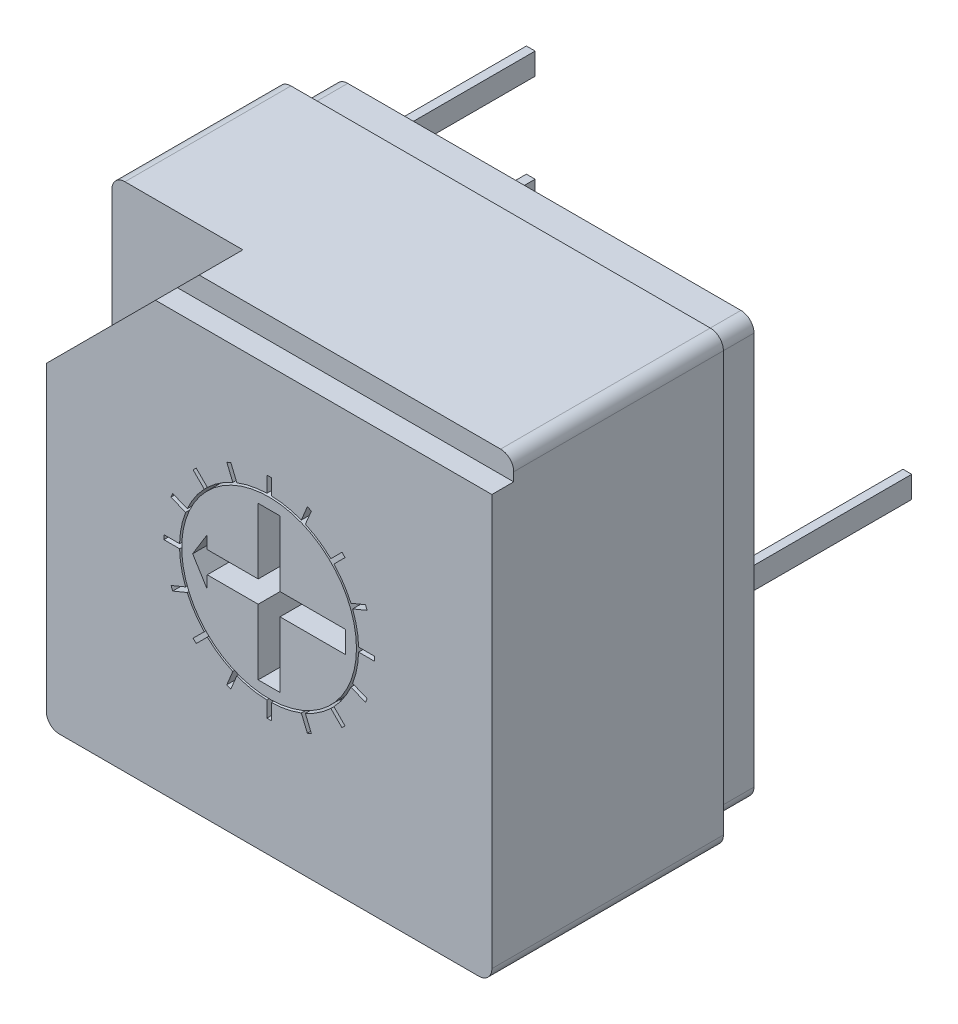
from build123d import *

# Parameters (mm, degrees)
SKETCH1_W               = 10.2
SKETCH1_H               = 10.2
BOSS_EXTRUDE2_DEPTH     = 6.5
SKETCH3_R               = 0.501534086
BOSS_EXTRUDE3_DEPTH     = 0.5
FILLET1_R               = 0.3
SKETCH4_W               = 10.2
SKETCH4_H               = 10.2
SKETCH4_W_2             = 9.6
SKETCH4_H_2             = 9.6
CUT_EXTRUDE_THIN1_DEPTH = 1
FILLET2_R               = 0.3
SKETCH5_W               = 0.2
SKETCH5_H               = 0.5
BOSS_EXTRUDE5_DEPTH     = 3.5
SKETCH6_W               = 0.2
SKETCH6_H               = 0.5
BOSS_EXTRUDE6_DEPTH     = 1
SKETCH7_W               = 10.2
SKETCH7_H               = 10.2
CUT_EXTRUDE3_DEPTH      = 0.2
CUT_EXTRUDE4_DEPTH      = 1.5
CUT_EXTRUDE5_DEPTH      = 0.5
SKETCH10_R              = 2.05
SKETCH10_R_2            = 2
CUT_EXTRUDE6_DEPTH      = 0.5
CUT_EXTRUDE7_DEPTH      = 1
CUT_EXTRUDE8_DEPTH      = 0.3


with BuildPart() as part:
    # Sketch1 → Boss-Extrude2 (new body)
    with BuildSketch(Plane.XY):
        with Locations((5.1, 5.1)):
            Rectangle(SKETCH1_W, SKETCH1_H)
    extrude(amount=BOSS_EXTRUDE2_DEPTH)

    # Sketch3 → Boss-Extrude3 (add)
    with BuildSketch(Plane(origin=(0, 0, 0), x_dir=(-1, 0, 0), z_dir=(0, 0, -1))):
        with Locations((-8.2, 8.2)):
            Circle(SKETCH3_R)
        with Locations(Location((-2, 8.2, 0), (0, 0, 180))):
            Circle(SKETCH3_R)
        with Locations(Location((-8.2, 2, 0), (0, 0, 180))):
            Circle(SKETCH3_R)
        with Locations((-2, 2)):
            Circle(SKETCH3_R)
    extrude(amount=BOSS_EXTRUDE3_DEPTH)

    # Fillet1
    fillet1_edges = [part.edges().sort_by_distance(p)[0] for p in [
        (0, 10.2, 3.25),
        (10.2, 10.2, 3.25),
        (10.2, 0, 3.25),
        (0, 0, 3.25),
    ]]
    fillet(fillet1_edges, radius=FILLET1_R)

    # Sketch4 → Cut-Extrude-Thin1 (cut)
    with BuildSketch(Plane(origin=(0, 0, 0), x_dir=(-1, 0, 0), z_dir=(0, 0, -1))):
        with Locations((-5.1, 5.1)):
            Rectangle(SKETCH4_W, SKETCH4_H)
        with Locations((-5.1, 5.1)):
            Rectangle(SKETCH4_W_2, SKETCH4_H_2, mode=Mode.SUBTRACT)
    extrude(amount=-CUT_EXTRUDE_THIN1_DEPTH, mode=Mode.SUBTRACT)

    # Fillet2
    fillet2_edges = [part.edges().sort_by_distance(p)[0] for p in [
        (9.9, 0.3, 0.5),
        (9.9, 9.9, 0.5),
        (0.3, 9.9, 0.5),
        (0.3, 0.3, 0.5),
    ]]
    fillet(fillet2_edges, radius=FILLET2_R)

    # Sketch5 → Boss-Extrude5 (add)
    with BuildSketch(Plane(origin=(0, 0, 0), x_dir=(-1, 0, 0), z_dir=(0, 0, -1))):
        with Locations((-1.29, 8.935868973)):
            Rectangle(SKETCH5_W, SKETCH5_H)
        with Locations((-1.29, 6.395868973)):
            Rectangle(SKETCH5_W, SKETCH5_H)
        with Locations((-1.29, 3.855868973)):
            Rectangle(SKETCH5_W, SKETCH5_H)
        with Locations((-1.29, 1.315868973)):
            Rectangle(SKETCH5_W, SKETCH5_H)
        with Locations((-8.91, 3.855868973)):
            Rectangle(SKETCH5_W, SKETCH5_H)
    extrude(amount=BOSS_EXTRUDE5_DEPTH)

    # Sketch6 → Boss-Extrude6 (add)
    with BuildSketch(Plane(origin=(0, 0, -3.5), x_dir=(-1, 0, 0), z_dir=(0, 0, -1))):
        with Locations((-8.91, 3.855868973)):
            Rectangle(SKETCH6_W, SKETCH6_H)
    extrude(amount=BOSS_EXTRUDE6_DEPTH)

    # Sketch7 → Cut-Extrude3 (cut)
    with BuildSketch(Plane.XY.offset(6.5)):
        with Locations((5.1, 5.1)):
            Rectangle(SKETCH7_W, SKETCH7_H)
    extrude(amount=-CUT_EXTRUDE3_DEPTH, mode=Mode.SUBTRACT)

    # Sketch8 → Cut-Extrude4 (cut)
    with BuildSketch(Plane.XY.offset(6.3)):
        Polygon((0, 10.2), (0, 7.2), (3, 10.2), align=None)
    extrude(amount=-CUT_EXTRUDE4_DEPTH, mode=Mode.SUBTRACT)

    # Sketch9 → Cut-Extrude5 (cut)
    with BuildSketch(Plane.XY.offset(6.3)):
        Polygon((3, 10.2), (10.2, 10.2), (10.2, 9.7), (2.5, 9.7), align=None)
    extrude(amount=-CUT_EXTRUDE5_DEPTH, mode=Mode.SUBTRACT)

    # Sketch10 → Cut-Extrude6 (cut)
    with BuildSketch(Plane.XY.offset(6.3)):
        with Locations((5.1, 5.1)):
            Circle(SKETCH10_R)
        with Locations((5.1, 5.1)):
            Circle(SKETCH10_R_2, mode=Mode.SUBTRACT)
    extrude(amount=-CUT_EXTRUDE6_DEPTH, mode=Mode.SUBTRACT)

    # Sketch11 → Cut-Extrude7 (cut)
    with BuildSketch(Plane.XY.offset(6.3)):
        Polygon((5.35, 6.85), (5.35, 5.35), (6.85, 5.35), (6.85, 4.85), (5.35, 4.85), (5.35, 3.35), (4.85, 3.35), (4.85, 4.85), (3.683893811, 4.85), (3.683893811, 4.56171007), (3.35, 5.1), (3.683893811, 5.645083537), (3.683893811, 5.35), (4.85, 5.35), (4.85, 6.85), align=None)
    extrude(amount=-CUT_EXTRUDE7_DEPTH, mode=Mode.SUBTRACT)

    # Sketch12 → Cut-Extrude8 (cut)
    with BuildSketch(Plane.XY.offset(6.3)):
        with BuildLine():
            Line((5.05, 7.509113019), (5.15, 7.509113019))
            Line((5.15, 7.509113019), (5.15, 7.149390153))
            ThreePointArc((5.15, 7.149390153), (5.1, 7.15), (5.05, 7.149390153))
            Line((5.05, 7.149390153), (5.05, 7.509113019))
        make_face()
        with BuildLine():
            Line((4.224266338, 7.344864381), (4.131878384, 7.306596038))
            Line((4.131878384, 7.306596038), (4.269538365, 6.974255445))
            ThreePointArc((4.269538365, 6.974255445), (4.315498964, 6.993953042), (4.361926319, 7.012523788))
            Line((4.361926319, 7.012523788), (4.224266338, 7.344864381))
        make_face()
        with BuildLine():
            Line((2.855135619, 5.975733662), (3.187476212, 5.838073681))
            ThreePointArc((3.187476212, 5.838073681), (3.206046958, 5.884501036), (3.225744555, 5.930461635))
            Line((3.225744555, 5.930461635), (2.893403962, 6.068121616))
            Line((2.893403962, 6.068121616), (2.855135619, 5.975733662))
        make_face()
        with BuildLine():
            Line((2.690886981, 5.15), (2.690886981, 5.05))
            Line((2.690886981, 5.05), (3.050609847, 5.05))
            ThreePointArc((3.050609847, 5.05), (3.05, 5.1), (3.050609847, 5.15))
            Line((3.050609847, 5.15), (2.690886981, 5.15))
        make_face()
        with BuildLine():
            Line((3.431855187, 6.838855491), (3.361144509, 6.768144813))
            Line((3.361144509, 6.768144813), (3.615506986, 6.513782336))
            ThreePointArc((3.615506986, 6.513782336), (3.650431099, 6.549568901), (3.686217664, 6.584493014))
            Line((3.686217664, 6.584493014), (3.431855187, 6.838855491))
        make_face()
        with BuildLine():
            Line((3.431855187, 3.361144509), (3.686217664, 3.615506986))
            ThreePointArc((3.686217664, 3.615506986), (3.650431099, 3.650431099), (3.615506986, 3.686217664))
            Line((3.615506986, 3.686217664), (3.361144509, 3.431855187))
            Line((3.361144509, 3.431855187), (3.431855187, 3.361144509))
        make_face()
        with BuildLine():
            Line((4.131878384, 2.893403962), (4.224266338, 2.855135619))
            Line((4.224266338, 2.855135619), (4.361926319, 3.187476212))
            ThreePointArc((4.361926319, 3.187476212), (4.315498964, 3.206046958), (4.269538365, 3.225744555))
            Line((4.269538365, 3.225744555), (4.131878384, 2.893403962))
        make_face()
        with BuildLine():
            Line((5.15, 2.690886981), (5.15, 3.050609847))
            ThreePointArc((5.15, 3.050609847), (5.1, 3.05), (5.05, 3.050609847))
            Line((5.05, 3.050609847), (5.05, 2.690886981))
            Line((5.05, 2.690886981), (5.15, 2.690886981))
        make_face()
        with BuildLine():
            Line((6.068121616, 2.893403962), (5.930461635, 3.225744555))
            ThreePointArc((5.930461635, 3.225744555), (5.884501036, 3.206046958), (5.838073681, 3.187476212))
            Line((5.838073681, 3.187476212), (5.975733662, 2.855135619))
            Line((5.975733662, 2.855135619), (6.068121616, 2.893403962))
        make_face()
        with BuildLine():
            Line((6.768144813, 3.361144509), (6.838855491, 3.431855187))
            Line((6.838855491, 3.431855187), (6.584493014, 3.686217664))
            ThreePointArc((6.584493014, 3.686217664), (6.549568901, 3.650431099), (6.513782336, 3.615506986))
            Line((6.513782336, 3.615506986), (6.768144813, 3.361144509))
        make_face()
        with BuildLine():
            Line((2.855135619, 4.224266338), (2.893403962, 4.131878384))
            Line((2.893403962, 4.131878384), (3.225744555, 4.269538365))
            ThreePointArc((3.225744555, 4.269538365), (3.206046958, 4.315498964), (3.187476212, 4.361926319))
            Line((3.187476212, 4.361926319), (2.855135619, 4.224266338))
        make_face()
        with BuildLine():
            Line((7.344864381, 4.224266338), (7.012523788, 4.361926319))
            ThreePointArc((7.012523788, 4.361926319), (6.993953042, 4.315498964), (6.974255445, 4.269538365))
            Line((6.974255445, 4.269538365), (7.306596038, 4.131878384))
            Line((7.306596038, 4.131878384), (7.344864381, 4.224266338))
        make_face()
        with BuildLine():
            Line((7.509113019, 5.15), (7.149390153, 5.15))
            ThreePointArc((7.149390153, 5.15), (7.15, 5.1), (7.149390153, 5.05))
            Line((7.149390153, 5.05), (7.509113019, 5.05))
            Line((7.509113019, 5.05), (7.509113019, 5.15))
        make_face()
        with BuildLine():
            Line((7.344864381, 5.975733662), (7.306596038, 6.068121616))
            Line((7.306596038, 6.068121616), (6.974255445, 5.930461635))
            ThreePointArc((6.974255445, 5.930461635), (6.993953042, 5.884501036), (7.012523788, 5.838073681))
            Line((7.012523788, 5.838073681), (7.344864381, 5.975733662))
        make_face()
        with BuildLine():
            Line((6.768144813, 6.838855491), (6.513782336, 6.584493014))
            ThreePointArc((6.513782336, 6.584493014), (6.549568901, 6.549568901), (6.584493014, 6.513782336))
            Line((6.584493014, 6.513782336), (6.838855491, 6.768144813))
            Line((6.838855491, 6.768144813), (6.768144813, 6.838855491))
        make_face()
        with BuildLine():
            Line((5.975733662, 7.344864381), (5.838073681, 7.012523788))
            ThreePointArc((5.838073681, 7.012523788), (5.884501036, 6.993953042), (5.930461635, 6.974255445))
            Line((5.930461635, 6.974255445), (6.068121616, 7.306596038))
            Line((6.068121616, 7.306596038), (5.975733662, 7.344864381))
        make_face()
    extrude(amount=-CUT_EXTRUDE8_DEPTH, mode=Mode.SUBTRACT)


solid = part.part
